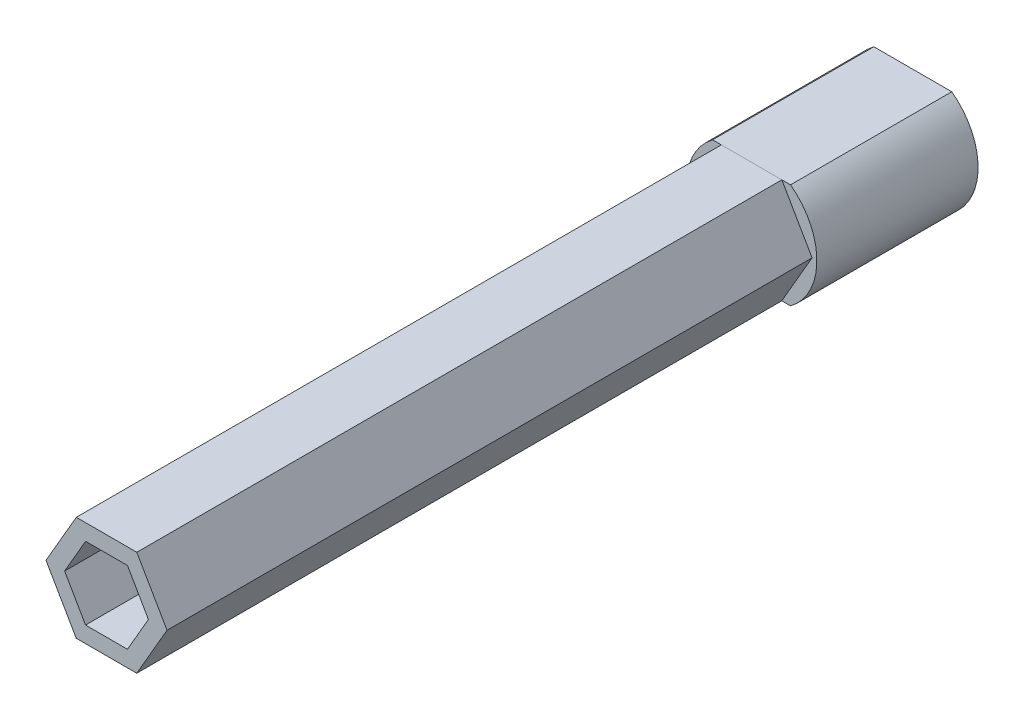
from build123d import *

# Parameters (mm, degrees)
BOSS_EXTRUDE2_DEPTH     = 10
BOSS_EXTRUDE3_DEPTH     = 40
CUT_EXTRUDE3_DEPTH      = 51.268999561
CUT_EXTRUDE3_DEPTH_BACK = 40
CUT_EXTRUDE4_DEPTH      = 10


with BuildPart() as part:
    # Sketch1 → Boss-Extrude2 (new body)
    with BuildSketch(Plane.XY):
        with BuildLine():
            Line((-2.416609195, 3.25), (2.416609195, 3.25))
            ThreePointArc((2.416609195, 3.25), (4.05, 0), (2.416609195, -3.25))
            Line((2.416609195, -3.25), (-2.416609195, -3.25))
            ThreePointArc((-2.416609195, -3.25), (-4.05, 0), (-2.416609195, 3.25))
        make_face()
    extrude(amount=BOSS_EXTRUDE2_DEPTH)

    # Sketch4 → Boss-Extrude3 (add)
    with BuildSketch(Plane.XY.offset(10)):
        Polygon((1.87443765, -3.251125471), (3.752776074, -0.002252112), (1.878338424, 3.248873359), (-1.87443765, 3.251125471), (-3.752776074, 0.002252112), (-1.878338424, -3.248873359), align=None)
    extrude(amount=BOSS_EXTRUDE3_DEPTH)

    # Sketch5 → Cut-Extrude3 (cut, two sides: drawn at the far end of the back side and taken through both)
    with BuildSketch(Plane.XY.offset(50).offset(-CUT_EXTRUDE3_DEPTH_BACK)):
        Polygon((-1.300388139, -2.249220017), (1.297687604, -2.250779172), (2.598075744, -0.001559155), (1.300388139, 2.249220017), (-1.297687604, 2.250779172), (-2.598075744, 0.001559155), align=None)
    extrude(amount=CUT_EXTRUDE3_DEPTH + CUT_EXTRUDE3_DEPTH_BACK, mode=Mode.SUBTRACT)

    # Sketch3 → Cut-Extrude4 (cut)
    with BuildSketch(Plane(origin=(0, 0, 0), x_dir=(-1, 0, 0), z_dir=(0, 0, -1))):
        with BuildLine():
            Line((1.854723699, 1.75), (-1.854723699, 1.75))
            ThreePointArc((-1.854723699, 1.75), (-2.55, 0), (-1.854723699, -1.75))
            Line((-1.854723699, -1.75), (1.854723699, -1.75))
            ThreePointArc((1.854723699, -1.75), (2.55, 0), (1.854723699, 1.75))
        make_face()
    extrude(amount=-CUT_EXTRUDE4_DEPTH, mode=Mode.SUBTRACT)


solid = part.part
